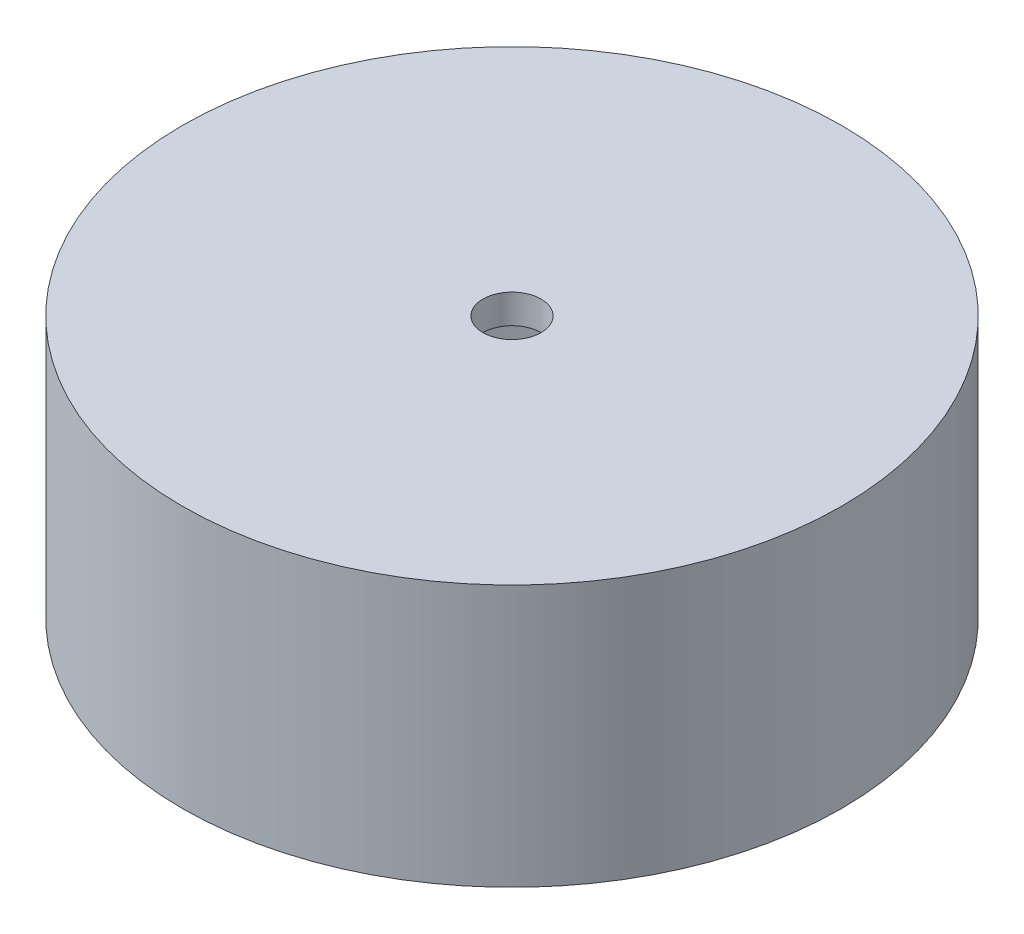
from build123d import *

# Parameters (mm, degrees)
SKETCH1_R               = 8.5
SKETCH1_R_2             = 7
BOSS_EXTRUDE1_DEPTH     = 6
SKETCH2_R               = 8.5
BOSS_EXTRUDE2_DEPTH     = 0.75
CUT_EXTRUDE1_DEPTH      = 14.786315679
CUT_EXTRUDE1_DEPTH_BACK = 14.786315679
SKETCH3_R               = 0.75
FILLET1_R               = 0.5


with BuildPart() as part:
    # Sketch1 → Boss-Extrude1 (new body)
    with BuildSketch(Plane(origin=(0, 0, 0), x_dir=(1, 0, 0), z_dir=(0, 1, 0))):
        with Locations(Location((0, 0, 0), (0, 0, 270))):
            Circle(SKETCH1_R)
        with Locations(Location((0, 0, 0), (0, 0, 270))):
            Circle(SKETCH1_R_2, mode=Mode.SUBTRACT)
    extrude(amount=BOSS_EXTRUDE1_DEPTH)

    # Sketch2 → Boss-Extrude2 (add)
    with BuildSketch(Plane(origin=(0, 6, 0), x_dir=(1, 0, 0), z_dir=(0, 1, 0))):
        with Locations(Location((0, 0, 0), (0, 0, 270))):
            Circle(SKETCH2_R)
    extrude(amount=BOSS_EXTRUDE2_DEPTH)

    # Sketch3 → Cut-Extrude1 (cut, two sides: drawn at the far end of the back side and taken through both)
    with BuildSketch(Plane(origin=(0, 6.75, 0), x_dir=(1, 0, 0), z_dir=(0, 1, 0)).offset(-CUT_EXTRUDE1_DEPTH_BACK)):
        with Locations(Location((0, 0, 0), (0, 0, 270))):
            Circle(SKETCH3_R)
    extrude(amount=CUT_EXTRUDE1_DEPTH + CUT_EXTRUDE1_DEPTH_BACK, mode=Mode.SUBTRACT)

    # Fillet1
    fillet1_edges = [part.edges().sort_by_distance(p)[0] for p in [
        (0, 0, -7),
    ]]
    fillet(fillet1_edges, radius=FILLET1_R)


solid = part.part
